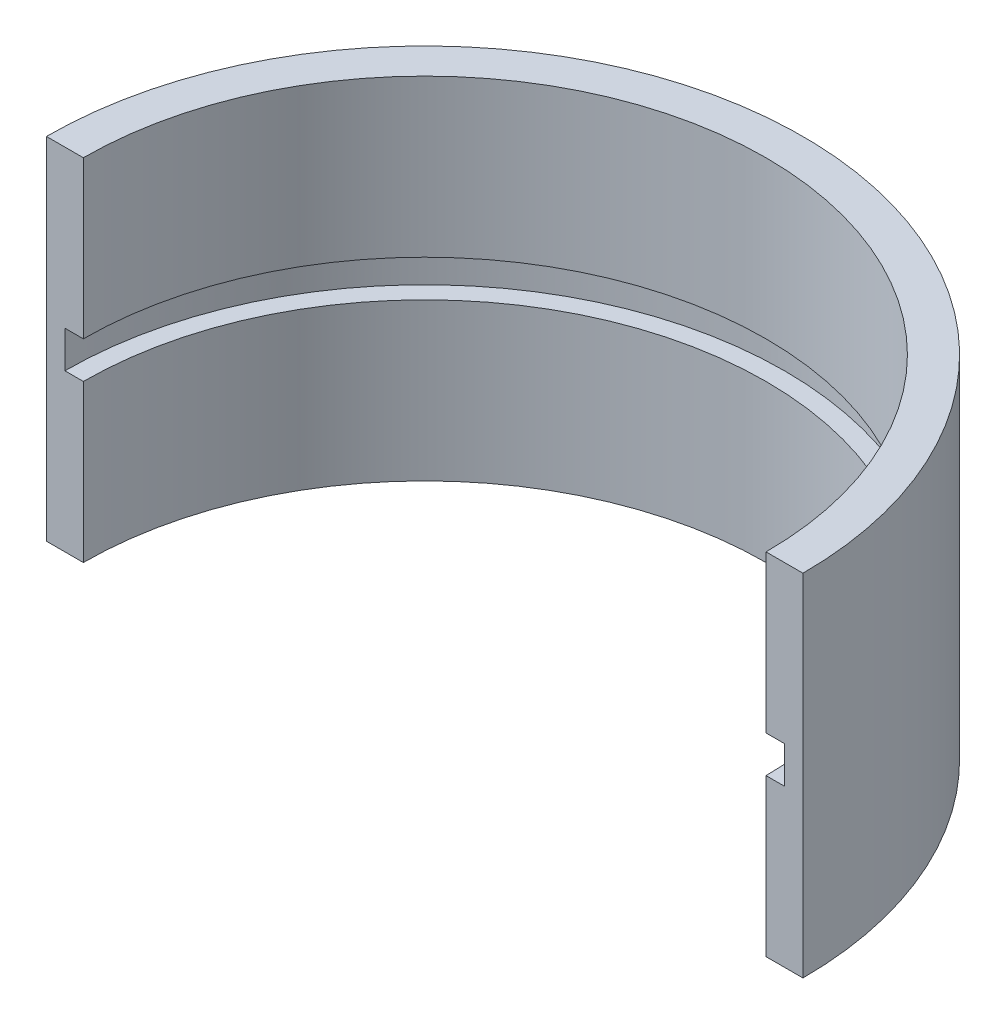
from build123d import *

# Parameters (mm, degrees)
BOSS_EXTRUDE1_DEPTH = 8.5
BOSS_EXTRUDE2_DEPTH = 2
BOSS_EXTRUDE3_DEPTH = 8.5


with BuildPart() as part:
    # Sketch1 → Boss-Extrude1 (new body)
    with BuildSketch(Plane(origin=(0, 0, 0), x_dir=(1, 0, 0), z_dir=(0, 1, 0))):
        with BuildLine():
            ThreePointArc((-18.5, 0), (0, 18.5), (18.5, 0))
            Line((18.5, 0), (20.5, 0))
            ThreePointArc((20.5, 0), (0, 20.5), (-20.5, 0))
            Line((-20.5, 0), (-18.5, 0))
        make_face()
    extrude(amount=BOSS_EXTRUDE1_DEPTH)

    # Sketch2 → Boss-Extrude2 (add)
    with BuildSketch(Plane(origin=(0, 8.5, 0), x_dir=(1, 0, 0), z_dir=(0, 1, 0))):
        with BuildLine():
            Line((-19.5, 0), (-20.5, 0))
            ThreePointArc((-20.5, 0), (0, 20.5), (20.5, 0))
            Line((20.5, 0), (19.5, 0))
            ThreePointArc((19.5, 0), (0, 19.5), (-19.5, 0))
        make_face()
    extrude(amount=BOSS_EXTRUDE2_DEPTH)

    # Sketch3 → Boss-Extrude3 (add)
    with BuildSketch(Plane(origin=(0, 10.5, 0), x_dir=(1, 0, 0), z_dir=(0, 1, 0))):
        with BuildLine():
            Line((-20.5, 0), (-18.5, 0))
            ThreePointArc((-18.5, 0), (0, 18.5), (18.5, 0))
            Line((18.5, 0), (20.5, 0))
            ThreePointArc((20.5, 0), (0, 20.5), (-20.5, 0))
        make_face()
    extrude(amount=BOSS_EXTRUDE3_DEPTH)


solid = part.part
